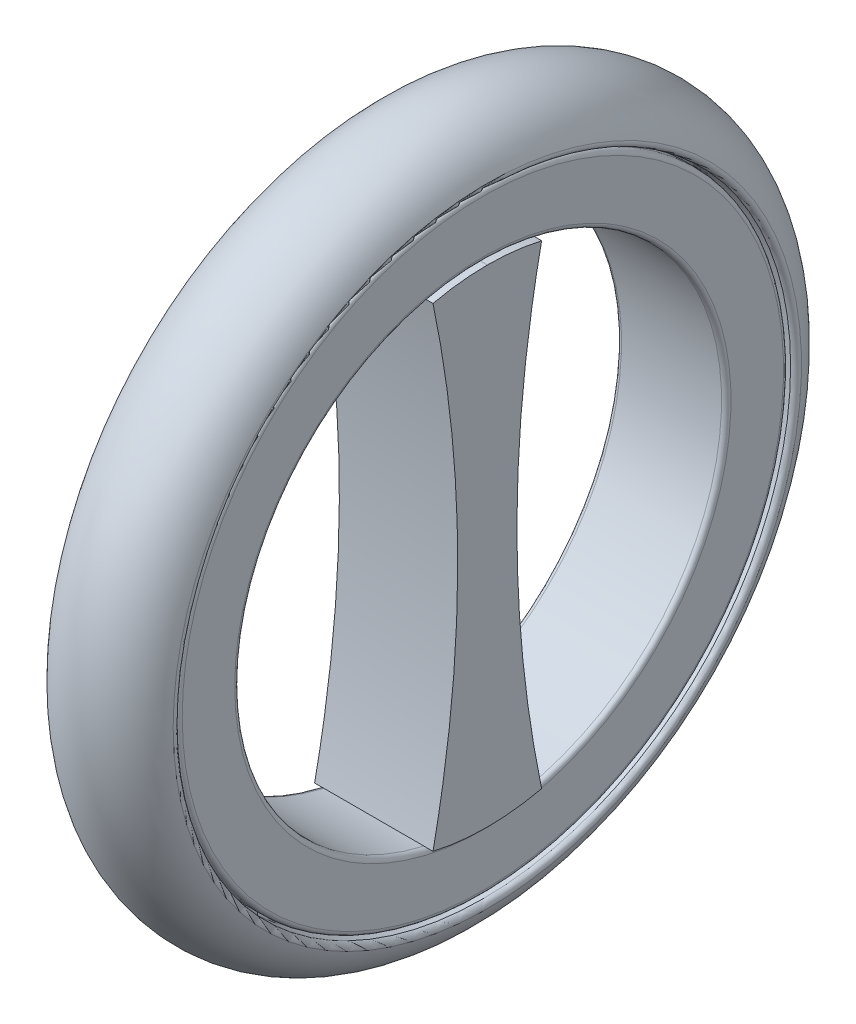
from build123d import *

# Parameters (mm, degrees)
BOSS_EXTRUDE2_DEPTH      = 25
BOSS_EXTRUDE2_DEPTH_BACK = 25


with BuildPart() as part:
    # Sketch6 → Revolve3 (revolve)
    with BuildSketch(Plane.XY, mode=Mode.PRIVATE) as revolve3_sk:
        with BuildLine():
            Line((-23.127844847, 129.984643661), (-16.274578516, 129.984643661))
            ThreePointArc((-16.274578516, 129.984643661), (-14.860364954, 129.398857223), (-14.274578516, 127.984643661))
            Line((-14.274578516, 127.984643661), (-14.274578516, 125.292811813))
            ThreePointArc((-14.274578516, 125.292811813), (-13.688792079, 123.87859825), (-12.274578516, 123.292811813))
            Line((-12.274578516, 123.292811813), (12.274578516, 123.292811813))
            ThreePointArc((12.274578516, 123.292811813), (13.688792079, 123.87859825), (14.274578516, 125.292811813))
            Line((14.274578516, 125.292811813), (14.274578516, 127.984643661))
            ThreePointArc((14.274578516, 127.984643661), (14.860364954, 129.398857223), (16.274578516, 129.984643661))
            Line((16.274578516, 129.984643661), (23.127844847, 129.984643661))
            ThreePointArc((23.127844847, 129.984643661), (24.772103736, 130.846042455), (25, 132.688230955))
            ThreePointArc((25, 132.688230955), (0, 150), (-25, 132.688230955))
            ThreePointArc((-25, 132.688230955), (-24.772103736, 130.846042455), (-23.127844847, 129.984643661))
        make_face()
        with BuildLine():
            Line((-21.127844847, 128.984643661), (-16.274578516, 128.984643661))
            ThreePointArc((-16.274578516, 128.984643661), (-15.567471735, 128.691750442), (-15.274578516, 127.984643661))
            Line((-15.274578516, 127.984643661), (-15.274578516, 125.292811813))
            ThreePointArc((-15.274578516, 125.292811813), (-14.39589886, 123.171491469), (-12.274578516, 122.292811813))
            Line((-12.274578516, 122.292811813), (12.274578516, 122.292811813))
            ThreePointArc((12.274578516, 122.292811813), (14.39589886, 123.171491469), (15.274578516, 125.292811813))
            Line((15.274578516, 125.292811813), (15.274578516, 127.984643661))
            ThreePointArc((15.274578516, 127.984643661), (15.567471735, 128.691750442), (16.274578516, 128.984643661))
            Line((16.274578516, 128.984643661), (21.127844847, 128.984643661))
            ThreePointArc((21.127844847, 128.984643661), (22.542058409, 128.398857223), (23.127844847, 126.984643661))
            Line((23.127844847, 126.984643661), (23.127844847, 104.801572089))
            ThreePointArc((23.127844847, 104.801572089), (22.542058409, 103.387358527), (21.127844847, 102.801572089))
            Line((21.127844847, 102.801572089), (12.274578516, 102.801572089))
            Line((12.274578516, 102.801572089), (-12.274578516, 102.801572089))
            Line((-12.274578516, 102.801572089), (-21.127844847, 102.801572089))
            ThreePointArc((-21.127844847, 102.801572089), (-22.542058409, 103.387358527), (-23.127844847, 104.801572089))
            Line((-23.127844847, 104.801572089), (-23.127844847, 126.984643661))
            ThreePointArc((-23.127844847, 126.984643661), (-22.542058409, 128.398857223), (-21.127844847, 128.984643661))
        make_face()
    revolve(revolve3_sk.sketch.rotate(Axis((-27.5, 0, 0), (1, 0, 0)), 90), axis=Axis((-27.5, 0, 0), (1, 0, 0)))


with BuildPart() as body_2:
    # Sketch7 → Boss-Extrude2 (new, two sides: drawn at the far end of the back side and taken through both)
    with BuildSketch(Plane(origin=(0, 0, 0), x_dir=(0, 0, -1), z_dir=(1, 0, 0)).offset(-BOSS_EXTRUDE2_DEPTH_BACK)):
        with BuildLine():
            add(Edge.make_bspline(
                [(-22.942623897, 100.208778222), (-2.05940828, 3.94e-07), (-22.942667972, -100.208768131)],
                knots=[0, 0, 0, 1, 1, 1], degree=2))
            add(Edge.make_bspline(
                [(-22.942667972, -100.208768131), (-11.588299862, -102.800085456), (-1.357e-06, -102.801572089)],
                knots=[0, 0, 0, 1, 1, 1], degree=2))
            add(Edge.make_bspline(
                [(22.942665258, -100.208768131), (11.588297148, -102.800085456), (-1.357e-06, -102.801572089)],
                knots=[0, 0, 0, 1, 1, 1], degree=2))
            add(Edge.make_bspline(
                [(22.942621184, 100.208778222), (2.059405566, 3.94e-07), (22.942665258, -100.208768131)],
                knots=[0, 0, 0, 1, 1, 1], degree=2))
            add(Edge.make_bspline(
                [(22.942621184, 100.208778222), (11.609436631, 102.79830451), (-1.357e-06, 102.801572089)],
                knots=[0, 0, 0, 1, 1, 1], degree=2))
            add(Edge.make_bspline(
                [(-22.942623897, 100.208778222), (-11.609439344, 102.79830451), (-1.357e-06, 102.801572089)],
                knots=[0, 0, 0, 1, 1, 1], degree=2))
        make_face()
    extrude(amount=BOSS_EXTRUDE2_DEPTH + BOSS_EXTRUDE2_DEPTH_BACK)


solid = Compound([part.part, body_2.part])
